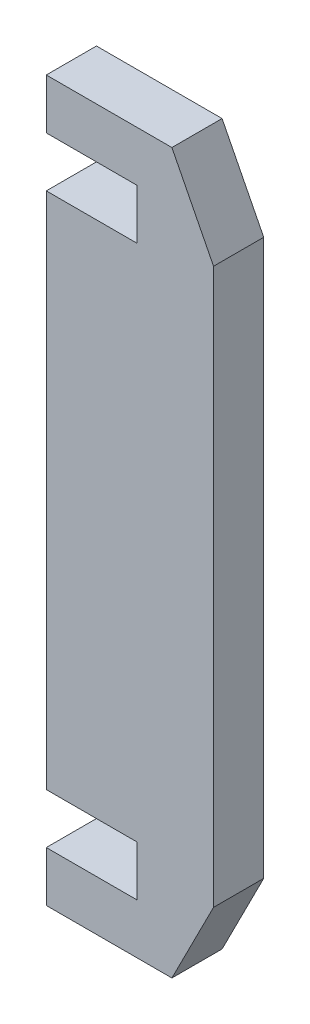
from build123d import *

# Parameters (mm, degrees)
BASE_EXTRUDE_DEPTH = 3


with BuildPart() as part:
    # Sketch1 → Base-Extrude (new body)
    with BuildSketch(Plane.XY):
        Polygon((882.909650659, -114.517142196), (882.909650659, -81.323420009), (880.419804328, -76.420281102), (872.909650659, -76.420281102), (872.909650659, -79.420281102), (878.318576624, -79.420281102), (878.318576624, -82.420281102), (872.909650659, -82.420281102), (872.909650659, -103.499568009), (872.909650659, -113.420281102), (878.318576624, -113.420281102), (878.318576624, -116.420281102), (872.909650659, -116.420281102), (872.909650659, -119.420281102), (880.419804328, -119.420281102), align=None)
    extrude(amount=BASE_EXTRUDE_DEPTH)


solid = part.part
